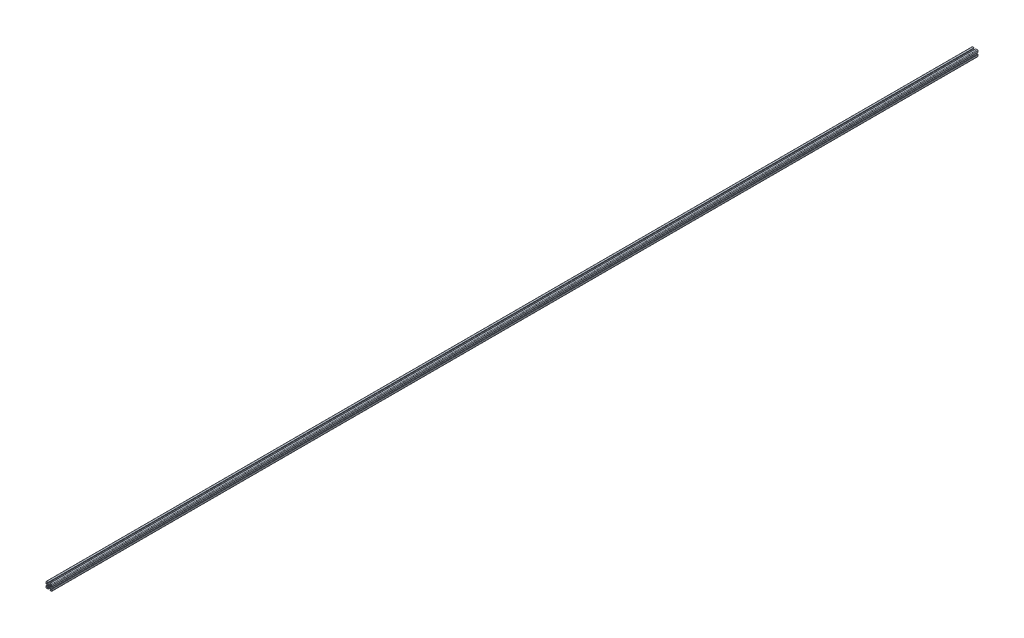
from build123d import *

# Parameters (mm, degrees)
BOSS_EXTRUDE1_DEPTH = 1524
CIRPATTERN1_COUNT   = 4


with BuildPart() as part:
    # Sketch3 → Boss-Extrude1 (new, symmetric)
    with BuildSketch(Plane.XY):
        with BuildLine():
            Line((-2.524916986, 8.30911066), (-2.500487338, 9.008684239))
            ThreePointArc((-2.500487338, 9.008684239), (-2.714917039, 9.582202525), (-3.272080403, 9.836116498))
            Line((-3.272080403, 9.836116498), (-7.930201007, 9.998781654))
            ThreePointArc((-7.930201007, 9.998781654), (-9.414213562, 9.414213562), (-9.998781654, 7.930201007))
            Line((-9.998781654, 7.930201007), (-9.836116498, 3.272080403))
            ThreePointArc((-9.836116498, 3.272080403), (-9.582202525, 2.714917039), (-9.008684239, 2.500487338))
            Line((-9.008684239, 2.500487338), (-8.30911066, 2.524916986))
            ThreePointArc((-8.30911066, 2.524916986), (-8.100174399, 2.620134726), (-8.019763261, 2.835204083))
            Line((-8.019763261, 2.835204083), (-8.093719461, 4.953032548))
            ThreePointArc((-8.093719461, 4.953032548), (-7.631170264, 5.686128657), (-6.779559917, 5.52444538))
            Line((-6.779559917, 5.52444538), (-4.478679656, 3.22356512))
            ThreePointArc((-4.478679656, 3.22356512), (-3.828361402, 2.250295073), (-3.6, 1.102244776))
            Line((-3.6, 1.102244776), (-3.6, 0))
            Line((-3.6, 0), (-2.15, 0))
            ThreePointArc((-2.15, 0), (-1.52027958, 1.52027958), (0, 2.15))
            Line((0, 2.15), (0, 3.6))
            Line((0, 3.6), (-1.102244776, 3.6))
            ThreePointArc((-1.102244776, 3.6), (-2.250295073, 3.828361402), (-3.22356512, 4.478679656))
            Line((-3.22356512, 4.478679656), (-5.52444538, 6.779559917))
            ThreePointArc((-5.52444538, 6.779559917), (-5.686128657, 7.631170264), (-4.953032548, 8.093719461))
            Line((-4.953032548, 8.093719461), (-2.835204083, 8.019763261))
            ThreePointArc((-2.835204083, 8.019763261), (-2.620134726, 8.100174399), (-2.524916986, 8.30911066))
        make_face()
    boss_extrude1 = extrude(amount=BOSS_EXTRUDE1_DEPTH, both=True)

    # CirPattern1: Boss-Extrude1 ×4 about axis
    cirpattern1_axis = Axis((0, 0, 0), (0, 0, 1))
    for i in range(1, CIRPATTERN1_COUNT):
        add(boss_extrude1.rotate(cirpattern1_axis, i * 360 / CIRPATTERN1_COUNT))


solid = part.part
